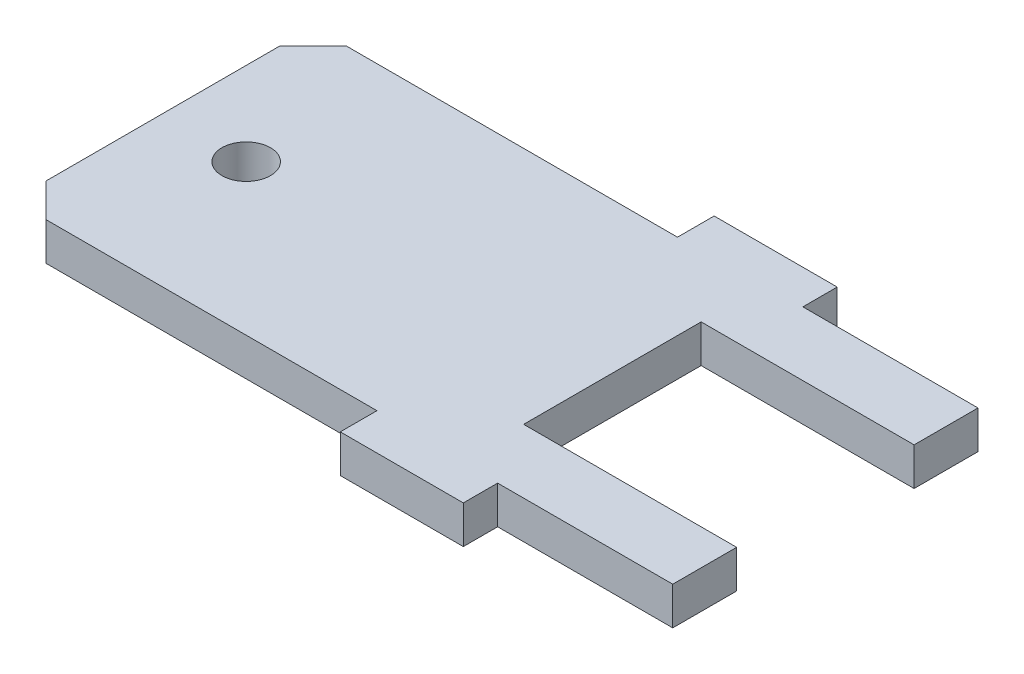
from build123d import *

# Parameters (mm, degrees)
SKETCH_1_R      = 0.512380356
EXTRUDE_1_DEPTH = 0.4


with BuildPart() as part:
    # Эскиз1 → Бобышка-Вытянуть1 (new, symmetric)
    with BuildSketch(Plane(origin=(0, 0, 0), x_dir=(1, 0, 0), z_dir=(0, 1, 0))):
        Polygon((0, -2.467893219), (0, 2.467893219), (0.707106781, 3.175), (7.7, 3.175), (7.7, 3.95), (10.3, 3.95), (10.3, 3.225), (14, 3.225), (14, 1.875), (9.5, 1.875), (9.5, -1.875), (14, -1.875), (14, -3.225), (10.3, -3.225), (10.3, -3.95), (7.7, -3.95), (7.7, -3.175), (0.707106781, -3.175), align=None)
        with Locations(Location((1.761903111, 0, 0), (0, 0, 270))):
            Circle(SKETCH_1_R, mode=Mode.SUBTRACT)
    extrude(amount=EXTRUDE_1_DEPTH, both=True)


solid = part.part
